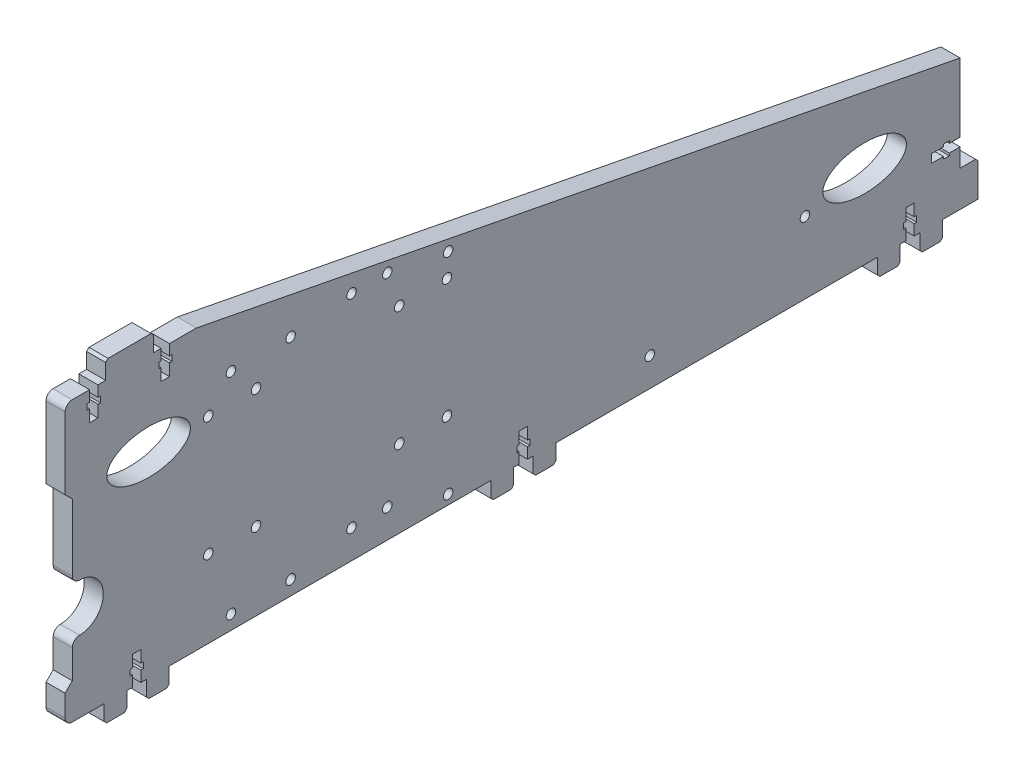
from build123d import *

# Parameters (mm, degrees)
SKETCH1_R          = 2
SKETCH1_RX         = 17.5
SKETCH1_RY         = 9.25
EXTRUDE1_DEPTH     = 8
SKETCH2_R          = 1
EXTRUDE2_DEPTH     = 1
SKETCH3_R          = 1
EXTRUDE3_DEPTH     = 1
SKETCH4_R          = 1
EXTRUDE4_DEPTH     = 1
SKETCH5_R          = 1
EXTRUDE5_DEPTH     = 1
SKETCH6_R          = 1
EXTRUDE6_DEPTH     = 1
CHAMFER1_SIZE      = 1
SKETCH7_R          = 2
CUT_EXTRUDE1_DEPTH = 408.249860484


with BuildPart() as part:
    # Sketch1 → Extrude1 (new body)
    with BuildSketch(Plane(origin=(0, 0, 0), x_dir=(0, 0, -1), z_dir=(1, 0, 0))):
        with BuildLine():
            Line((377.011143547, 9.438901563), (384.511143547, 9.438901563))
            Line((384.511143547, 9.438901563), (384.511143547, 24.438901563))
            Line((384.511143547, 24.438901563), (377.011143547, 24.438901563))
            Line((377.011143547, 24.438901563), (377.011143547, 32.188901563))
            Line((377.011143547, 32.188901563), (372.511143547, 32.188901563))
            Line((372.511143547, 32.188901563), (372.511143547, 31.188901563))
            Line((372.511143547, 31.188901563), (370.011143547, 31.188901563))
            Line((370.011143547, 31.188901563), (370.011143547, 32.188901563))
            Line((370.011143547, 32.188901563), (365.011143547, 32.188901563))
            Line((365.011143547, 32.188901563), (365.011143547, 35.688901563))
            Line((365.011143547, 35.688901563), (370.011143547, 35.688901563))
            Line((370.011143547, 35.688901563), (370.011143547, 36.688901563))
            Line((370.011143547, 36.688901563), (372.511143547, 36.688901563))
            Line((372.511143547, 36.688901563), (372.511143547, 35.688901563))
            Line((372.511143547, 35.688901563), (377.011143547, 35.688901563))
            Line((377.011143547, 35.688901563), (377.011143547, 64.438901563))
            Line((377.011143547, 64.438901563), (57.011143547, 126.438901563))
            Line((57.011143547, 126.438901563), (45.761143547, 126.438901563))
            Line((45.761143547, 126.438901563), (45.761143547, 121.938901563))
            Line((45.761143547, 121.938901563), (46.761143547, 121.938901563))
            Line((46.761143547, 121.938901563), (46.761143547, 119.438901563))
            Line((46.761143547, 119.438901563), (45.761143547, 119.438901563))
            Line((45.761143547, 119.438901563), (45.761143547, 114.438901563))
            Line((45.761143547, 114.438901563), (42.261143547, 114.438901563))
            Line((42.261143547, 114.438901563), (42.261143547, 119.438901563))
            Line((42.261143547, 119.438901563), (41.261143547, 119.438901563))
            Line((41.261143547, 119.438901563), (41.261143547, 121.938901563))
            Line((41.261143547, 121.938901563), (42.261143547, 121.938901563))
            Line((42.261143547, 121.938901563), (42.261143547, 126.438901563))
            Line((42.261143547, 126.438901563), (39.011143547, 126.438901563))
            Line((39.011143547, 126.438901563), (39.011143547, 132.938901563))
            Line((39.011143547, 132.938901563), (38.011143547, 133.938901563))
            Line((38.011143547, 133.938901563), (20.011143547, 133.938901563))
            Line((20.011143547, 133.938901563), (19.011143547, 132.938901563))
            Line((19.011143547, 132.938901563), (19.011143547, 126.438901563))
            Line((19.011143547, 126.438901563), (15.761143547, 126.438901563))
            Line((15.761143547, 126.438901563), (15.761143547, 121.938901563))
            Line((15.761143547, 121.938901563), (16.761143547, 121.938901563))
            Line((16.761143547, 121.938901563), (16.761143547, 119.438901563))
            Line((16.761143547, 119.438901563), (15.761143547, 119.438901563))
            Line((15.761143547, 119.438901563), (15.761143547, 114.438901563))
            Line((15.761143547, 114.438901563), (12.261143547, 114.438901563))
            Line((12.261143547, 114.438901563), (12.261143547, 119.438901563))
            Line((12.261143547, 119.438901563), (11.261143547, 119.438901563))
            Line((11.261143547, 119.438901563), (11.261143547, 121.938901563))
            Line((11.261143547, 121.938901563), (12.261143547, 121.938901563))
            Line((12.261143547, 121.938901563), (12.261143547, 126.438901563))
            Line((12.261143547, 126.438901563), (5.011143547, 126.438901563))
            ThreePointArc((5.011143547, 126.438901563), (2.889823204, 125.560221906), (2.011143547, 123.438901563))
            Line((2.011143547, 123.438901563), (2.011143547, 93.438901563))
            Line((2.011143547, 93.438901563), (5.011143547, 90.438901563))
            Line((5.011143547, 90.438901563), (5.011143547, 62.438901563))
            ThreePointArc((5.011143547, 62.438901563), (5.889823204, 60.317581219), (8.011143547, 59.438901563))
            ThreePointArc((8.011143547, 59.438901563), (18.011143547, 49.438901563), (8.011143547, 39.438901563))
            ThreePointArc((8.011143547, 39.438901563), (5.889823204, 38.560221906), (5.011143547, 36.438901563))
            Line((5.011143547, 36.438901563), (5.011143547, 24.438901563))
            Line((5.011143547, 24.438901563), (2.011143547, 21.438901563))
            Line((2.011143547, 21.438901563), (2.011143547, 12.438901563))
            ThreePointArc((2.011143547, 12.438901563), (2.889823204, 10.317581219), (5.011143547, 9.438901563))
            Line((5.011143547, 9.438901563), (18.386143547, 9.438901563))
            Line((18.386143547, 9.438901563), (18.386143547, 2.938901563))
            Line((18.386143547, 2.938901563), (19.386143547, 1.938901563))
            Line((19.386143547, 1.938901563), (26.886143547, 1.938901563))
            Line((26.886143547, 1.938901563), (27.886143547, 2.938901563))
            Line((27.886143547, 2.938901563), (27.886143547, 9.438901563))
            Line((27.886143547, 9.438901563), (30.261143547, 9.438901563))
            Line((30.261143547, 9.438901563), (30.261143547, 13.938901563))
            Line((30.261143547, 13.938901563), (29.261143547, 13.938901563))
            Line((29.261143547, 13.938901563), (29.261143547, 16.438901563))
            Line((29.261143547, 16.438901563), (30.261143547, 16.438901563))
            Line((30.261143547, 16.438901563), (30.261143547, 21.438901563))
            Line((30.261143547, 21.438901563), (33.761143547, 21.438901563))
            Line((33.761143547, 21.438901563), (33.761143547, 16.438901563))
            Line((33.761143547, 16.438901563), (34.761143547, 16.438901563))
            Line((34.761143547, 16.438901563), (34.761143547, 13.938901563))
            Line((34.761143547, 13.938901563), (33.761143547, 13.938901563))
            Line((33.761143547, 13.938901563), (33.761143547, 9.438901563))
            Line((33.761143547, 9.438901563), (36.136143547, 9.438901563))
            Line((36.136143547, 9.438901563), (36.136143547, 2.938901563))
            Line((36.136143547, 2.938901563), (37.136143547, 1.938901563))
            Line((37.136143547, 1.938901563), (44.636143547, 1.938901563))
            Line((44.636143547, 1.938901563), (45.636143547, 2.938901563))
            Line((45.636143547, 2.938901563), (45.636143547, 9.438901563))
            Line((45.636143547, 9.438901563), (180.386143547, 9.438901563))
            Line((180.386143547, 9.438901563), (180.386143547, 2.938901563))
            Line((180.386143547, 2.938901563), (181.386143547, 1.938901563))
            Line((181.386143547, 1.938901563), (188.886143547, 1.938901563))
            Line((188.886143547, 1.938901563), (189.886143547, 2.938901563))
            Line((189.886143547, 2.938901563), (189.886143547, 9.438901563))
            Line((189.886143547, 9.438901563), (192.261143547, 9.438901563))
            Line((192.261143547, 9.438901563), (192.261143547, 13.938901563))
            Line((192.261143547, 13.938901563), (191.261143547, 13.938901563))
            Line((191.261143547, 13.938901563), (191.261143547, 16.438901563))
            Line((191.261143547, 16.438901563), (192.261143547, 16.438901563))
            Line((192.261143547, 16.438901563), (192.261143547, 21.438901563))
            Line((192.261143547, 21.438901563), (195.761143547, 21.438901563))
            Line((195.761143547, 21.438901563), (195.761143547, 16.438901563))
            Line((195.761143547, 16.438901563), (196.761143547, 16.438901563))
            Line((196.761143547, 16.438901563), (196.761143547, 13.938901563))
            Line((196.761143547, 13.938901563), (195.761143547, 13.938901563))
            Line((195.761143547, 13.938901563), (195.761143547, 9.438901563))
            Line((195.761143547, 9.438901563), (198.136143547, 9.438901563))
            Line((198.136143547, 9.438901563), (198.136143547, 2.938901563))
            Line((198.136143547, 2.938901563), (199.136143547, 1.938901563))
            Line((199.136143547, 1.938901563), (206.636143547, 1.938901563))
            Line((206.636143547, 1.938901563), (207.636143547, 2.938901563))
            Line((207.636143547, 2.938901563), (207.636143547, 9.438901563))
            Line((207.636143547, 9.438901563), (342.386143547, 9.438901563))
            Line((342.386143547, 9.438901563), (342.386143547, 2.938901563))
            Line((342.386143547, 2.938901563), (343.386143547, 1.938901563))
            Line((343.386143547, 1.938901563), (350.886143547, 1.938901563))
            Line((350.886143547, 1.938901563), (351.886143547, 2.938901563))
            Line((351.886143547, 2.938901563), (351.886143547, 9.438901563))
            Line((351.886143547, 9.438901563), (354.261143547, 9.438901563))
            Line((354.261143547, 9.438901563), (354.261143547, 13.938901563))
            Line((354.261143547, 13.938901563), (353.261143547, 13.938901563))
            Line((353.261143547, 13.938901563), (353.261143547, 16.438901563))
            Line((353.261143547, 16.438901563), (354.261143547, 16.438901563))
            Line((354.261143547, 16.438901563), (354.261143547, 21.438901563))
            Line((354.261143547, 21.438901563), (357.761143547, 21.438901563))
            Line((357.761143547, 21.438901563), (357.761143547, 16.438901563))
            Line((357.761143547, 16.438901563), (358.761143547, 16.438901563))
            Line((358.761143547, 16.438901563), (358.761143547, 13.938901563))
            Line((358.761143547, 13.938901563), (357.761143547, 13.938901563))
            Line((357.761143547, 13.938901563), (357.761143547, 9.438901563))
            Line((357.761143547, 9.438901563), (360.136143547, 9.438901563))
            Line((360.136143547, 9.438901563), (360.136143547, 2.938901563))
            Line((360.136143547, 2.938901563), (361.136143547, 1.938901563))
            Line((361.136143547, 1.938901563), (368.636143547, 1.938901563))
            Line((368.636143547, 1.938901563), (369.636143547, 2.938901563))
            Line((369.636143547, 2.938901563), (369.636143547, 9.438901563))
            Line((369.636143547, 9.438901563), (377.011143547, 9.438901563))
        make_face()
        with Locations((71.511143547, 15.438901563)):
            Circle(SKETCH1_R, mode=Mode.SUBTRACT)
        with Locations((162.511143547, 13.438901563)):
            Circle(SKETCH1_R, mode=Mode.SUBTRACT)
        with Locations((71.511143547, 103.438901563)):
            Circle(SKETCH1_R, mode=Mode.SUBTRACT)
        with Locations((162.511143547, 101.438901563)):
            Circle(SKETCH1_R, mode=Mode.SUBTRACT)
        with Locations((122.011143547, 21.438901563)):
            Circle(SKETCH1_R, mode=Mode.SUBTRACT)
        with Locations((122.011143547, 106.438901563)):
            Circle(SKETCH1_R, mode=Mode.SUBTRACT)
        with Locations((247.011143547, 21.438901563)):
            Circle(SKETCH1_R, mode=Mode.SUBTRACT)
        with Locations((312.011143547, 39.438901563)):
            Circle(SKETCH1_R, mode=Mode.SUBTRACT)
        with Locations(Location((337.011143547, 44.438901563), (0, 0, 0))):
            Ellipse(SKETCH1_RX, SKETCH1_RY, mode=Mode.SUBTRACT)
        with Locations((37.011143547, 91.438901563)):
            Ellipse(SKETCH1_RX, SKETCH1_RY, mode=Mode.SUBTRACT)
    extrude(amount=EXTRUDE1_DEPTH)

    # Sketch2 → Extrude2 (cut)
    with BuildSketch(Plane(origin=(0, 114.438901563, 0), x_dir=(1, 0, 0), z_dir=(0, 1, 0))):
        with Locations(Location((4, 44.011143547, 0), (0, 0, 270))):
            Circle(SKETCH2_R)
    extrude(amount=-EXTRUDE2_DEPTH, mode=Mode.SUBTRACT)

    # Sketch3 → Extrude3 (cut)
    with BuildSketch(Plane(origin=(0, 114.438901563, 0), x_dir=(1, 0, 0), z_dir=(0, 1, 0))):
        with Locations(Location((4, 14.011143547, 0), (0, 0, 270))):
            Circle(SKETCH3_R)
    extrude(amount=-EXTRUDE3_DEPTH, mode=Mode.SUBTRACT)

    # Sketch4 → Extrude4 (cut)
    with BuildSketch(Plane.XZ.offset(-21.438901563)):
        with Locations(Location((4, -32.011143547, 0), (0, 0, 270))):
            Circle(SKETCH4_R)
    extrude(amount=-EXTRUDE4_DEPTH, mode=Mode.SUBTRACT)

    # Sketch5 → Extrude5 (cut)
    with BuildSketch(Plane.XZ.offset(-21.438901563)):
        with Locations(Location((4, -356.011143547, 0), (0, 0, 270))):
            Circle(SKETCH5_R)
    extrude(amount=-EXTRUDE5_DEPTH, mode=Mode.SUBTRACT)

    # Sketch6 → Extrude6 (cut)
    with BuildSketch(Plane(origin=(0, 0, -365.011143547), x_dir=(-1, 0, 0), z_dir=(0, 0, -1))):
        with Locations((-4, 33.938901563)):
            Circle(SKETCH6_R)
    extrude(amount=-EXTRUDE6_DEPTH, mode=Mode.SUBTRACT)

    # Chamfer1
    chamfer1_edges = [part.edges().sort_by_distance(p)[0] for p in [
        (4, 24.438901563, -384.511143547),
    ]]
    chamfer(chamfer1_edges, length=CHAMFER1_SIZE)

    # Sketch7 → Cut-Extrude1 (cut, through all)
    with BuildSketch(Plane(origin=(8, 0, 0), x_dir=(0, 0, -1), z_dir=(1, 0, 0))):
        with Locations((62.011143547, 41.938901563)):
            Circle(SKETCH7_R)
        with Locations((82.011143547, 41.938901563)):
            Circle(SKETCH7_R)
        with Locations((142.011143547, 41.938901563)):
            Circle(SKETCH7_R)
        with Locations((162.011143547, 41.938901563)):
            Circle(SKETCH7_R)
        with Locations((82.011143547, 91.938901563)):
            Circle(SKETCH7_R)
        with Locations((142.011143547, 91.938901563)):
            Circle(SKETCH7_R)
        with Locations((162.011143547, 91.938901563)):
            Circle(SKETCH7_R)
        with Locations((62.011143547, 91.938901563)):
            Circle(SKETCH7_R)
        with Locations((96.511143547, 103.438901563)):
            Circle(SKETCH7_R)
        with Locations((96.511143547, 15.438901563)):
            Circle(SKETCH7_R)
        with Locations((137.011143547, 21.438901563)):
            Circle(SKETCH7_R)
        with Locations((137.011143547, 106.438901563)):
            Circle(SKETCH7_R)
    extrude(amount=-CUT_EXTRUDE1_DEPTH, mode=Mode.SUBTRACT)


solid = part.part
